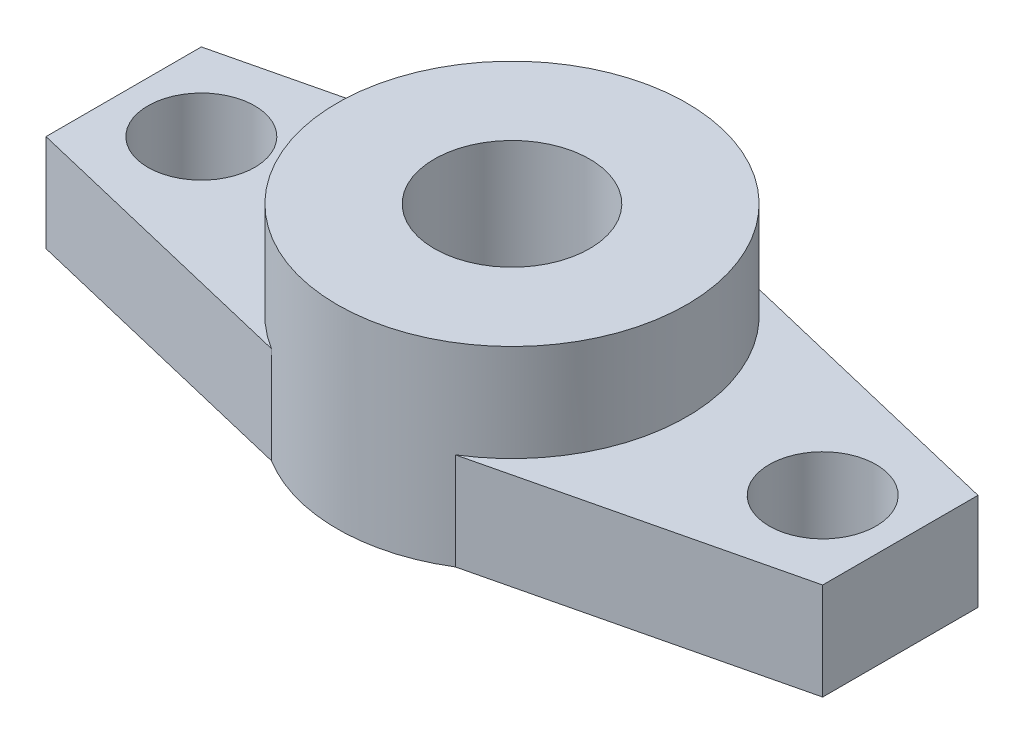
from build123d import *

# Parameters (mm, degrees)
SKETCH1_R           = 2.75
SKETCH1_R_2         = 4
BOSS_EXTRUDE1_DEPTH = 5
SKETCH1_3_R         = 4
BOSS_EXTRUDE2_DEPTH = 10


with BuildPart() as part:
    # Sketch1 → Boss-Extrude1 (new body)
    with BuildSketch(Plane(origin=(0, 0, 0), x_dir=(1, 0, 0), z_dir=(0, 1, 0))):
        with BuildLine():
            Line((-4.733723721, 7.654531974), (-20, 4))
            Line((-20, 4), (-20, -4))
            Line((-20, -4), (-4.733723721, -7.654531974))
            ThreePointArc((-4.733723721, -7.654531974), (0, -9), (4.733723721, -7.654531974))
            Line((4.733723721, -7.654531974), (20, -4))
            Line((20, -4), (20, 4))
            Line((20, 4), (4.733723721, 7.654531974))
            ThreePointArc((4.733723721, 7.654531974), (0, 9), (-4.733723721, 7.654531974))
        make_face()
        with Locations((-16, 0)):
            Circle(SKETCH1_R, mode=Mode.SUBTRACT)
        Circle(SKETCH1_R_2, mode=Mode.SUBTRACT)
        with Locations((16, 0)):
            Circle(SKETCH1_R, mode=Mode.SUBTRACT)
    extrude(amount=BOSS_EXTRUDE1_DEPTH)

    # Sketch1<3> → Boss-Extrude2 (add)
    with BuildSketch(Plane(origin=(0, 0, 0), x_dir=(1, 0, 0), z_dir=(0, 1, 0))):
        with BuildLine():
            ThreePointArc((4.733723721, 7.654531974), (0, 9), (-4.733723721, 7.654531974))
            ThreePointArc((-4.733723721, 7.654531974), (-9, 0), (-4.733723721, -7.654531974))
            ThreePointArc((-4.733723721, -7.654531974), (0, -9), (4.733723721, -7.654531974))
            ThreePointArc((4.733723721, -7.654531974), (7.861409336, -4.381579996), (9, 0))
            ThreePointArc((9, 0), (7.861409336, 4.381579996), (4.733723721, 7.654531974))
        make_face()
        Circle(SKETCH1_3_R, mode=Mode.SUBTRACT)
    extrude(amount=BOSS_EXTRUDE2_DEPTH)


solid = part.part
